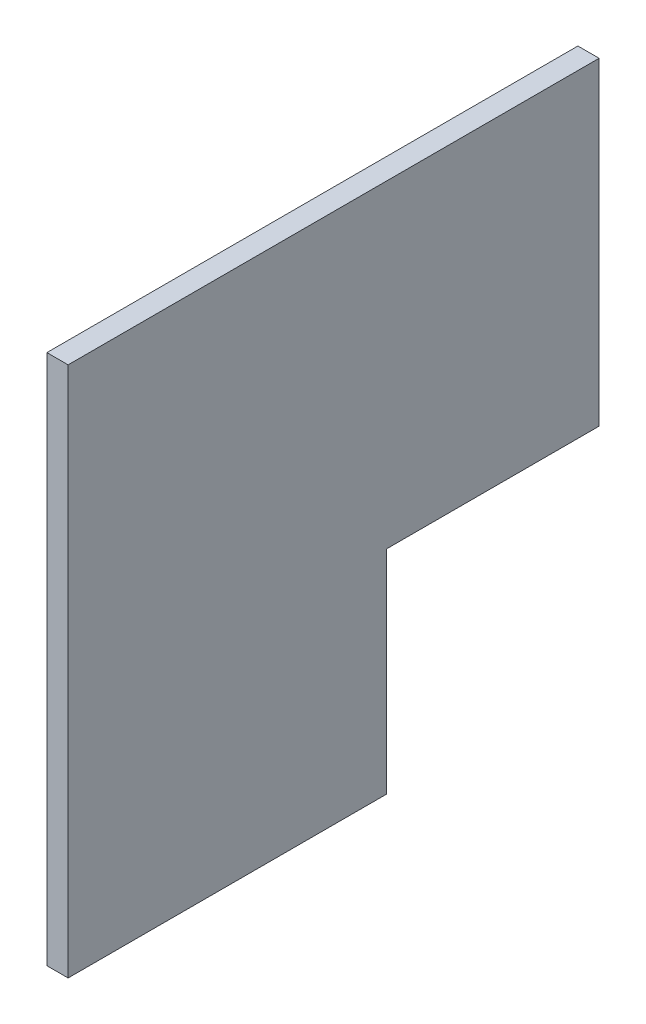
from build123d import *

# Parameters (mm, degrees)
BOSS_EXTRUDE1_DEPTH = 10


with BuildPart() as part:
    # Sketch1 → Boss-Extrude1 (new body)
    with BuildSketch(Plane.YZ):
        Polygon((0, 100), (100, 100), (100, 0), (250, 0), (250, 250), (0, 250), align=None)
    extrude(amount=BOSS_EXTRUDE1_DEPTH)


solid = part.part
